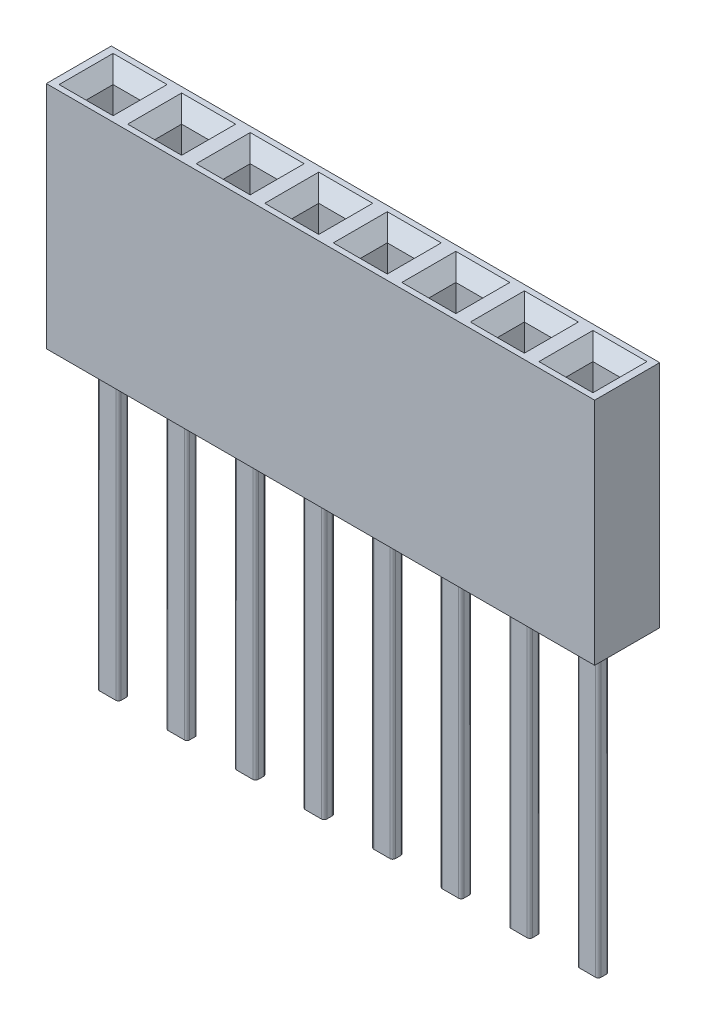
from build123d import *

# Parameters (mm, degrees)
SKETCH2_W                  = 20.32
SKETCH2_H                  = 2.41
BOSS_EXTRUDE1_DEPTH        = 8.51
SKETCH5_W                  = 1
SKETCH5_H                  = 1
CUT_EXTRUDE1_DEPTH         = 5
CHAMFER1_SIZE              = 0.5
LPATTERN3_COUNT            = 8
LPATTERN3_PITCH            = 2.54
CHAMFER1_OF_LPATTERN3_SIZE = 0.5
BOSS_EXTRUDE2_DEPTH        = 11
LPATTERN1_COUNT            = 8
LPATTERN1_PITCH            = 2.54


with BuildPart() as part:
    # Sketch2 → Boss-Extrude1 (new body)
    with BuildSketch(Plane(origin=(0, 0, 0), x_dir=(1, 0, 0), z_dir=(0, 1, 0))):
        with Locations((8.89, 0)):
            Rectangle(SKETCH2_W, SKETCH2_H)
    extrude(amount=BOSS_EXTRUDE1_DEPTH)

    # Sketch5 → Cut-Extrude1 (cut)
    with BuildSketch(Plane(origin=(0, 8.51, 0), x_dir=(1, 0, 0), z_dir=(0, 1, 0))):
        Rectangle(SKETCH5_W, SKETCH5_H)
    cut_extrude1 = extrude(amount=-CUT_EXTRUDE1_DEPTH, mode=Mode.SUBTRACT)

    # Chamfer1
    chamfer1_edges = [part.edges().sort_by_distance(p)[0] for p in [
        (-0.5, 8.51, 0),
        (0, 8.51, 0.5),
        (0.5, 8.51, 0),
        (0, 8.51, -0.5),
    ]]
    chamfer(chamfer1_edges, length=CHAMFER1_SIZE)

    # LPattern3: Cut-Extrude1 ×8
    with Locations(*[(i * LPATTERN3_PITCH, 0, 0) for i in range(1, LPATTERN3_COUNT)]):
        add(cut_extrude1, mode=Mode.SUBTRACT)

    # Chamfer1 of LPattern3
    chamfer1_of_lpattern3_edges = [part.edges().sort_by_distance(p)[0] for p in [
        (2.04, 8.51, 0),
        (2.54, 8.51, 0.5),
        (3.04, 8.51, 0),
        (2.54, 8.51, -0.5),
        (4.58, 8.51, 0),
        (5.08, 8.51, 0.5),
        (5.58, 8.51, 0),
        (5.08, 8.51, -0.5),
        (7.12, 8.51, 0),
        (7.62, 8.51, 0.5),
        (8.12, 8.51, 0),
        (7.62, 8.51, -0.5),
        (9.66, 8.51, 0),
        (10.16, 8.51, 0.5),
        (10.66, 8.51, 0),
        (10.16, 8.51, -0.5),
        (12.2, 8.51, 0),
        (12.7, 8.51, 0.5),
        (13.2, 8.51, 0),
        (12.7, 8.51, -0.5),
        (14.74, 8.51, 0),
        (15.24, 8.51, 0.5),
        (15.74, 8.51, 0),
        (15.24, 8.51, -0.5),
        (17.28, 8.51, 0),
        (17.78, 8.51, 0.5),
        (18.28, 8.51, 0),
        (17.78, 8.51, -0.5),
    ]]
    chamfer(chamfer1_of_lpattern3_edges, length=CHAMFER1_OF_LPATTERN3_SIZE)

    # Sketch8 → Boss-Extrude2 (add)
    with BuildSketch(Plane(origin=(0, 0, 0), x_dir=(1, 0, 0), z_dir=(0, 1, 0))):
        with BuildLine():
            Line((-0.3, -0.2), (0.3, -0.2))
            ThreePointArc((0.3, -0.2), (0.370710678, -0.170710678), (0.4, -0.1))
            Line((0.4, -0.1), (0.4, 0.1))
            ThreePointArc((0.4, 0.1), (0.370710678, 0.170710678), (0.3, 0.2))
            Line((0.3, 0.2), (-0.3, 0.2))
            ThreePointArc((-0.3, 0.2), (-0.370710678, 0.170710678), (-0.4, 0.1))
            Line((-0.4, 0.1), (-0.4, -0.1))
            ThreePointArc((-0.4, -0.1), (-0.370710678, -0.170710678), (-0.3, -0.2))
        make_face()
    boss_extrude2 = extrude(amount=-BOSS_EXTRUDE2_DEPTH)

    # LPattern1: Boss-Extrude2 ×8
    with Locations(*[(i * LPATTERN1_PITCH, 0, 0) for i in range(1, LPATTERN1_COUNT)]):
        add(boss_extrude2)


solid = part.part
